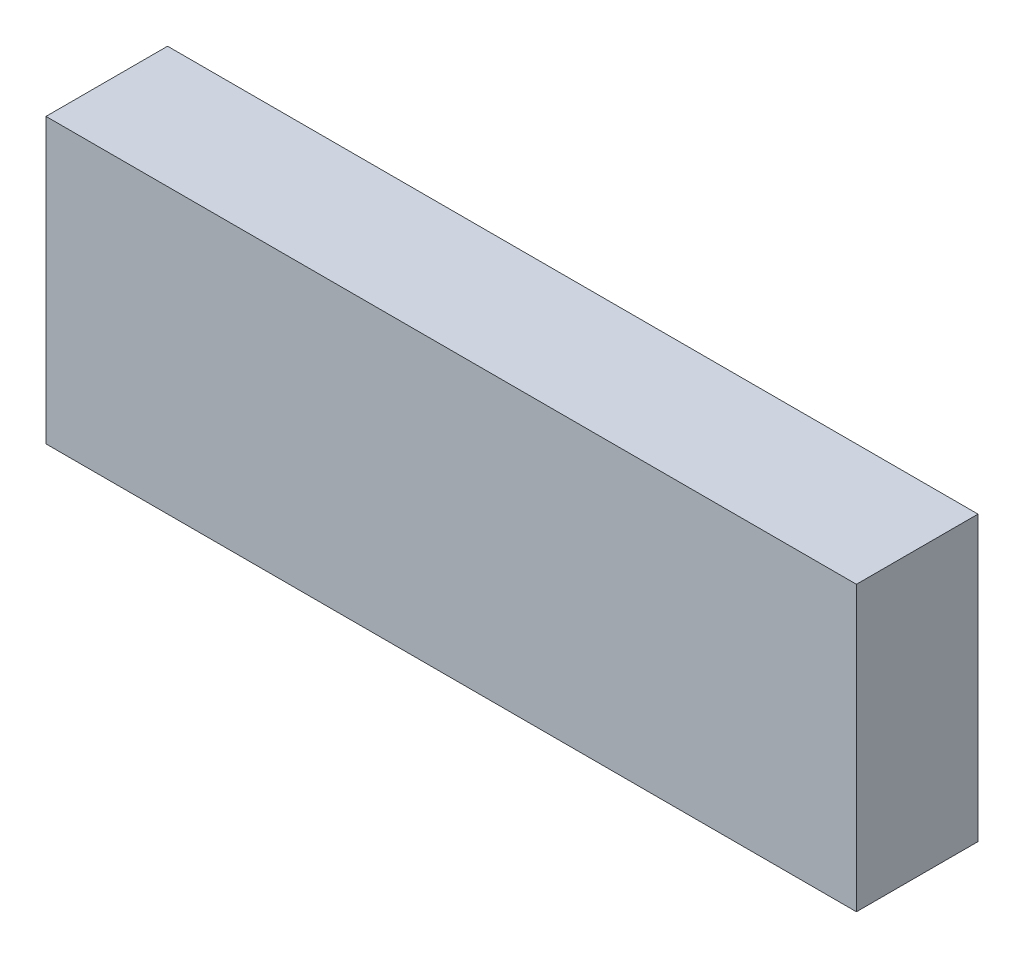
from build123d import *

# Parameters (mm, degrees)
SKETCH1_W           = 38.1
SKETCH1_H           = 88.9
BOSS_EXTRUDE1_DEPTH = 254


with BuildPart() as part:
    # Sketch1 → Boss-Extrude1 (new body)
    with BuildSketch(Plane(origin=(0, 0, 0), x_dir=(0, 0, -1), z_dir=(1, 0, 0))):
        Rectangle(SKETCH1_W, SKETCH1_H)
    extrude(amount=BOSS_EXTRUDE1_DEPTH)


solid = part.part
